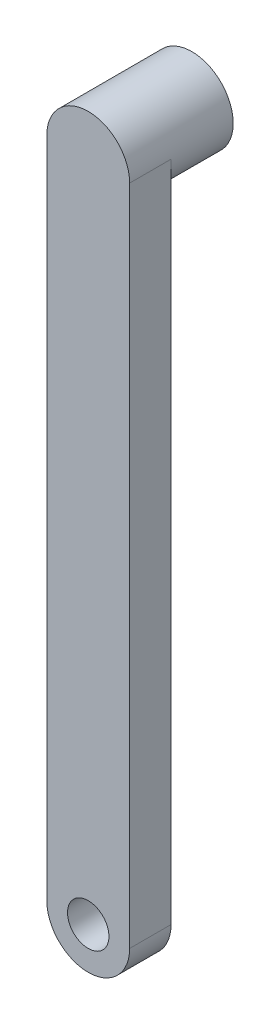
from build123d import *

# Parameters (mm, degrees)
RESSALTO_EXTRUS_O1_DEPTH   = 10
CORTE_EXTRUS_O1_DEPTH      = 112.394113732
CORTE_EXTRUS_O1_DEPTH_BACK = 112.394113732
ESBO_O2_R                  = 5
ESBO_O4_R                  = 10
RESSALTO_EXTRUS_O2_DEPTH   = 25


with BuildPart() as part:
    # Esboço1 → Ressalto-extrusão1 (new body)
    with BuildSketch(Plane.XY):
        with BuildLine():
            Line((-51.939383922, 71.964552472), (-51.939383922, -88.035447528))
            ThreePointArc((-51.939383922, -88.035447528), (-41.939383922, -98.035447528), (-31.939383922, -88.035447528))
            Line((-31.939383922, -88.035447528), (-31.939383922, 71.964552472))
            Line((-31.939383922, 71.964552472), (-51.939383922, 71.964552472))
        make_face()
    extrude(amount=RESSALTO_EXTRUS_O1_DEPTH)

    # Esboço2 → Corte-extrusão1 (cut, two sides: drawn at the far end of the back side and taken through both)
    with BuildSketch(Plane.XY.offset(10).offset(-CORTE_EXTRUS_O1_DEPTH_BACK)):
        with Locations((-41.939383922, -88.035447528)):
            Circle(ESBO_O2_R)
    extrude(amount=CORTE_EXTRUS_O1_DEPTH + CORTE_EXTRUS_O1_DEPTH_BACK, mode=Mode.SUBTRACT)

    # Esboço4 → Ressalto-extrusão2 (add)
    with BuildSketch(Plane.XY.offset(10)):
        with Locations((-41.939383922, 71.964552472)):
            Circle(ESBO_O4_R)
    extrude(amount=-RESSALTO_EXTRUS_O2_DEPTH)


solid = part.part
